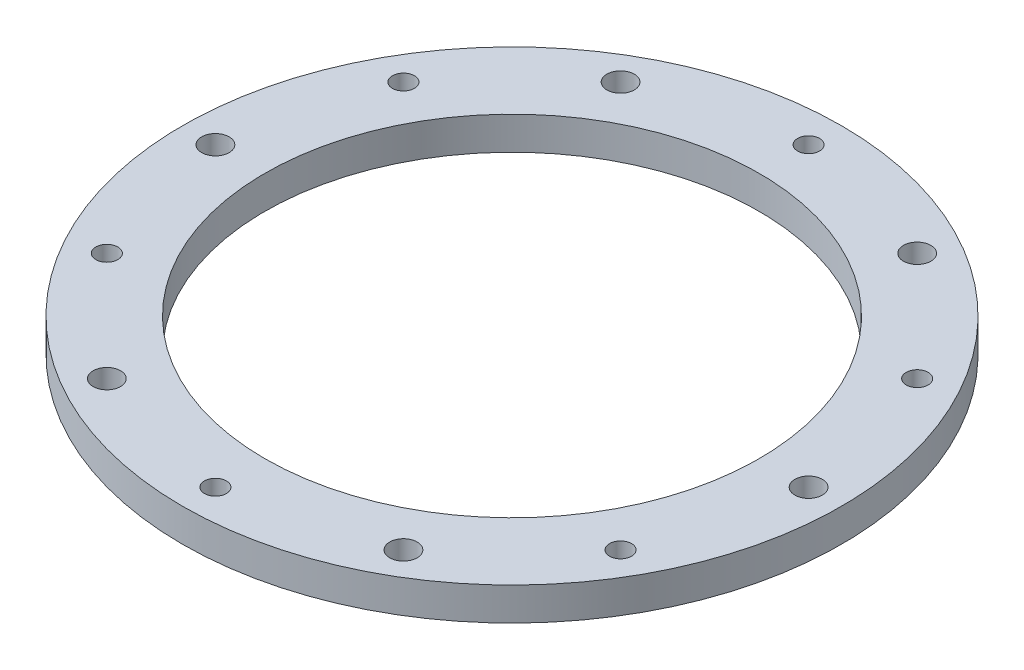
from build123d import *

# Parameters (mm, degrees)
SKETCH1_R           = 30
SKETCH1_R_2         = 1
SKETCH1_R_3         = 22.5
BOSS_EXTRUDE1_DEPTH = 3
SKETCH3_R           = 1.25
CUT_EXTRUDE1_DEPTH  = 3


with BuildPart() as part:
    # Sketch1 → Boss-Extrude1 (new body)
    with BuildSketch(Plane(origin=(0, 0, 0), x_dir=(1, 0, 0), z_dir=(0, 1, 0))):
        with Locations(Location((0, 0, 0), (0, 0, 270))):
            Circle(SKETCH1_R)
        with Locations(Location((0, 27, 0), (0, 0, 270))):
            Circle(SKETCH1_R_2, mode=Mode.SUBTRACT)
        with Locations(Location((23.382685902, 13.5, 0), (0, 0, 270))):
            Circle(SKETCH1_R_2, mode=Mode.SUBTRACT)
        with Locations(Location((23.382685902, -13.5, 0), (0, 0, 270))):
            Circle(SKETCH1_R_2, mode=Mode.SUBTRACT)
        with Locations(Location((0, -27, 0), (0, 0, 270))):
            Circle(SKETCH1_R_2, mode=Mode.SUBTRACT)
        with Locations(Location((-23.382685902, -13.5, 0), (0, 0, 270))):
            Circle(SKETCH1_R_2, mode=Mode.SUBTRACT)
        with Locations(Location((-23.382685902, 13.5, 0), (0, 0, 270))):
            Circle(SKETCH1_R_2, mode=Mode.SUBTRACT)
        with Locations(Location((0, 0, 0), (0, 0, 270))):
            Circle(SKETCH1_R_3, mode=Mode.SUBTRACT)
    extrude(amount=BOSS_EXTRUDE1_DEPTH)

    # Sketch3 → Cut-Extrude1 (cut)
    with BuildSketch(Plane(origin=(0, 3, 0), x_dir=(1, 0, 0), z_dir=(0, 1, 0))):
        with Locations(Location((-13.5, 23.382685902, 0), (0, 0, 270))):
            Circle(SKETCH3_R)
        with Locations(Location((13.5, 23.382685902, 0), (0, 0, 270))):
            Circle(SKETCH3_R)
        with Locations(Location((27, 0, 0), (0, 0, 270))):
            Circle(SKETCH3_R)
        with Locations(Location((13.5, -23.382685902, 0), (0, 0, 270))):
            Circle(SKETCH3_R)
        with Locations(Location((-13.5, -23.382685902, 0), (0, 0, 270))):
            Circle(SKETCH3_R)
        with Locations(Location((-27, 0, 0), (0, 0, 270))):
            Circle(SKETCH3_R)
    extrude(amount=-CUT_EXTRUDE1_DEPTH, mode=Mode.SUBTRACT)


solid = part.part
